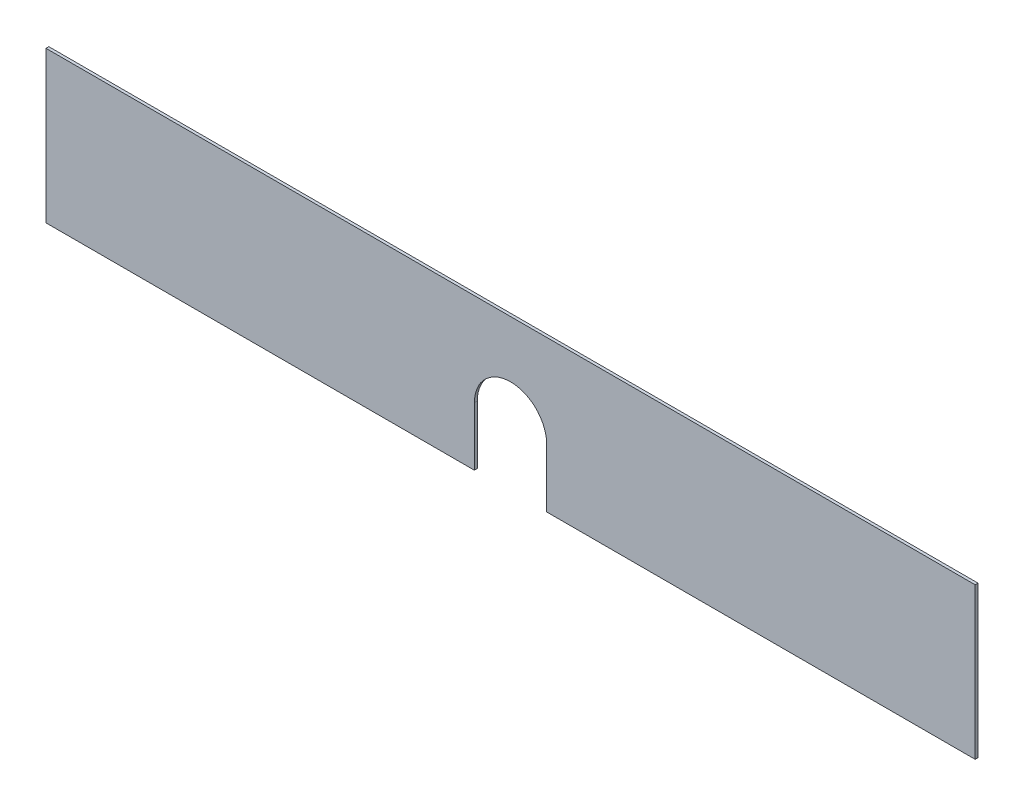
from build123d import *

# Parameters (mm, degrees)
BOSS_EXTRUDE1_DEPTH = 1


with BuildPart() as part:
    # Sketch1 → Boss-Extrude1 (new body)
    with BuildSketch(Plane.XY):
        with BuildLine():
            Line((0, 0), (0, 53))
            Line((0, 53), (325.71, 53))
            Line((325.71, 53), (325.71, 0))
            Line((325.71, 0), (175.535, 0))
            Line((175.535, 0), (175.535, 20.5))
            ThreePointArc((175.535, 20.5), (162.855, 33.18), (150.175, 20.5))
            Line((150.175, 20.5), (150.175, 0))
            Line((150.175, 0), (0, 0))
        make_face()
    extrude(amount=BOSS_EXTRUDE1_DEPTH)


solid = part.part
